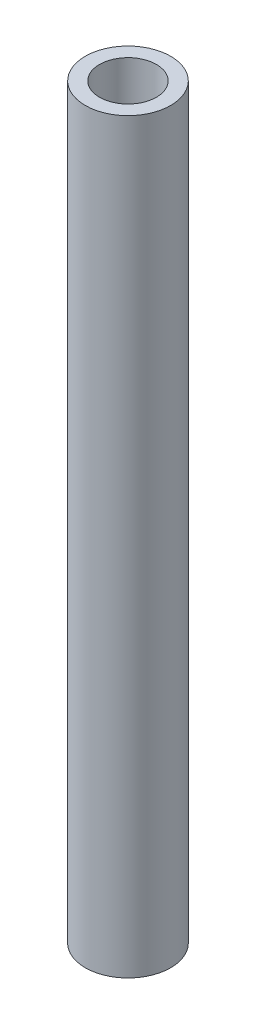
from build123d import *

# Parameters (mm, degrees)
SKETCH1_R           = 3
SKETCH1_R_2         = 2
BOSS_EXTRUDE1_DEPTH = 52.5


with BuildPart() as part:
    # Sketch1 → Boss-Extrude1 (new body)
    with BuildSketch(Plane(origin=(0, 0, 0), x_dir=(1, 0, 0), z_dir=(0, 1, 0))):
        with Locations(Location((0, 0, 0), (0, 0, 270))):
            Circle(SKETCH1_R)
        with Locations(Location((0, 0, 0), (0, 0, 270))):
            Circle(SKETCH1_R_2, mode=Mode.SUBTRACT)
    extrude(amount=BOSS_EXTRUDE1_DEPTH)


solid = part.part
